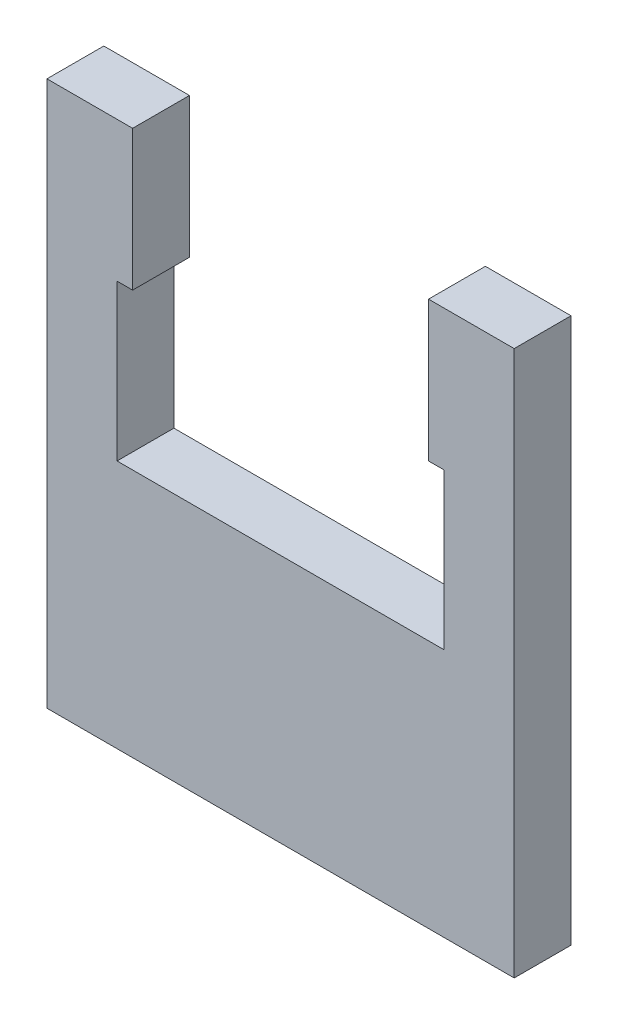
from build123d import *

# Parameters (mm, degrees)
BOSS_EXTRUDE1_DEPTH = 9.271


with BuildPart() as part:
    # Sketch1 → Boss-Extrude1 (new body)
    with BuildSketch(Plane(origin=(0, 0, 0), x_dir=(0, 1, 0), z_dir=(0, 0, 1))):
        Polygon((0, 78.200532541), (-22.86, 78.200532541), (-22.86, 80.740532541), (-48.26, 80.740532541), (-48.26, 27.400532541), (-22.86, 27.400532541), (-22.86, 29.940532541), (0, 29.940532541), (0, 15.970532541), (-88.9, 15.970532541), (-88.9, 92.170532541), (0, 92.170532541), align=None)
    extrude(amount=BOSS_EXTRUDE1_DEPTH)


solid = part.part
